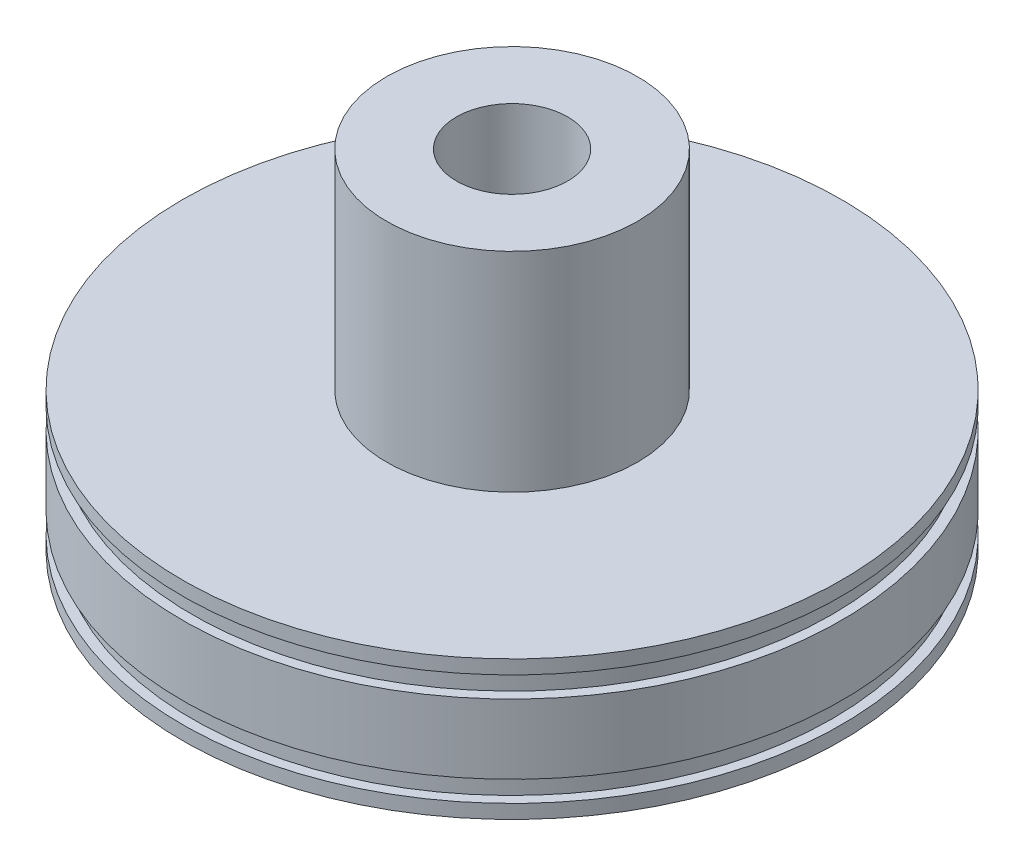
from build123d import *

# Parameters (mm, degrees)
SKETCH2_R           = 11.4554
BOSS_EXTRUDE1_DEPTH = 19.05
SKETCH3_R           = 5.08
CUT_EXTRUDE1_DEPTH  = 12.7


with BuildPart() as part:
    # Sketch1 → Revolve1 (revolve)
    with BuildSketch(Plane.XY, mode=Mode.PRIVATE) as revolve1_sk:
        Polygon((0, 19.05), (0, 0), (30.099, 18.085303772), (30.099, 19.355303772), (29.21, 19.355303772), (29.21, 21.260303772), (30.099, 21.260303772), (30.099, 27.610303772), (29.21, 27.610303772), (29.21, 29.515303772), (30.099, 29.515303772), (30.099, 30.785303772), (0, 30.785303772), align=None)
    revolve(revolve1_sk.sketch.rotate(Axis((0, 30.785303772, 0), (0, -1, 0)), 180), axis=Axis((0, 30.785303772, 0), (0, -1, 0)))

    # Sketch2 → Boss-Extrude1 (add)
    with BuildSketch(Plane(origin=(0, 30.785303772, 0), x_dir=(1, 0, 0), z_dir=(0, 1, 0))):
        Circle(SKETCH2_R)
    extrude(amount=BOSS_EXTRUDE1_DEPTH)

    # Sketch3 → Cut-Extrude1 (cut)
    with BuildSketch(Plane(origin=(0, 49.835303772, 0), x_dir=(1, 0, 0), z_dir=(0, 1, 0))):
        with Locations(Location((0, 0, 0), (0, 0, 180))):
            Circle(SKETCH3_R)
    extrude(amount=-CUT_EXTRUDE1_DEPTH, mode=Mode.SUBTRACT)


solid = part.part
